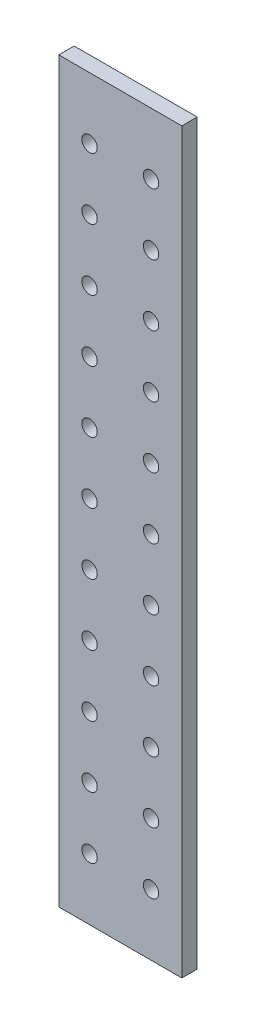
from build123d import *

# Parameters (mm, degrees)
SKETCH1_W               = 50.8
SKETCH1_H               = 304.8
BOSS_EXTRUDE1_DEPTH     = 3.175
CUT_EXTRUDE1_DEPTH      = 155.53478775
CUT_EXTRUDE1_DEPTH_BACK = 155.53478775
SKETCH2_R               = 3.175


with BuildPart() as part:
    # Sketch1 → Boss-Extrude1 (new, symmetric)
    with BuildSketch(Plane.XY):
        Rectangle(SKETCH1_W, SKETCH1_H)
    extrude(amount=BOSS_EXTRUDE1_DEPTH, both=True)

    # Sketch2 → Cut-Extrude1 (cut, two sides: drawn at the far end of the back side and taken through both)
    with BuildSketch(Plane.XY.offset(-CUT_EXTRUDE1_DEPTH_BACK)):
        with Locations((-12.7, 127)):
            Circle(SKETCH2_R)
        with Locations((12.7, 127)):
            Circle(SKETCH2_R)
        with Locations((12.7, 101.6)):
            Circle(SKETCH2_R)
        with Locations((12.7, 76.2)):
            Circle(SKETCH2_R)
        with Locations((12.7, 50.8)):
            Circle(SKETCH2_R)
        with Locations((12.7, 25.4)):
            Circle(SKETCH2_R)
        with Locations((12.7, 0)):
            Circle(SKETCH2_R)
        with Locations((12.7, -25.4)):
            Circle(SKETCH2_R)
        with Locations((12.7, -50.8)):
            Circle(SKETCH2_R)
        with Locations((12.7, -76.2)):
            Circle(SKETCH2_R)
        with Locations((12.7, -101.6)):
            Circle(SKETCH2_R)
        with Locations((-12.7, 101.6)):
            Circle(SKETCH2_R)
        with Locations((-12.7, 76.2)):
            Circle(SKETCH2_R)
        with Locations((-12.7, 50.8)):
            Circle(SKETCH2_R)
        with Locations((-12.7, 25.4)):
            Circle(SKETCH2_R)
        with Locations((-12.7, 0)):
            Circle(SKETCH2_R)
        with Locations((-12.7, -25.4)):
            Circle(SKETCH2_R)
        with Locations((-12.7, -50.8)):
            Circle(SKETCH2_R)
        with Locations((-12.7, -76.2)):
            Circle(SKETCH2_R)
        with Locations((-12.7, -101.6)):
            Circle(SKETCH2_R)
        with Locations((-12.7, -127)):
            Circle(SKETCH2_R)
        with Locations((12.7, -127)):
            Circle(SKETCH2_R)
    extrude(amount=CUT_EXTRUDE1_DEPTH + CUT_EXTRUDE1_DEPTH_BACK, mode=Mode.SUBTRACT)


solid = part.part
